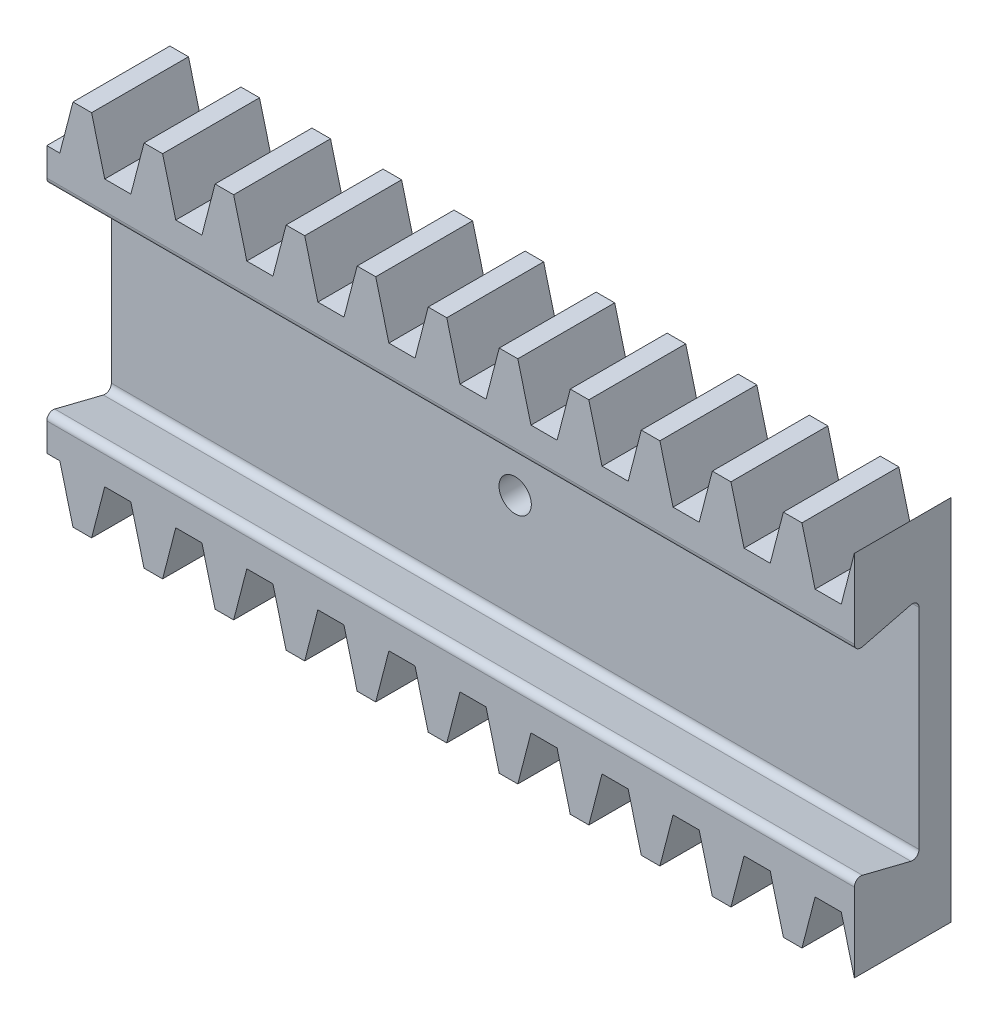
from build123d import *

# Parameters (mm, degrees)
BLANKSKE_W             = 25
BLANKSKE_H             = 5.7
BLANK_DEPTH            = 3
TOOTHCUTSIM_DEPTH      = 26.816467613
TEETHCUTS_COUNT        = 12
TEETHCUTS_PITCH        = 2.199114855
MIRROR_2_COPY_1_DEPTH  = 26.816467613
MIRROR_2_COPY_2_DEPTH  = 26.816467613
MIRROR_2_COPY_3_DEPTH  = 26.816467613
MIRROR_2_COPY_4_DEPTH  = 26.816467613
MIRROR_2_COPY_5_DEPTH  = 26.816467613
MIRROR_2_COPY_6_DEPTH  = 26.816467613
MIRROR_2_COPY_7_DEPTH  = 26.816467613
MIRROR_2_COPY_8_DEPTH  = 26.816467613
MIRROR_2_COPY_9_DEPTH  = 26.816467613
MIRROR_2_COPY_10_DEPTH = 26.816467613
MIRROR_2_COPY_11_DEPTH = 26.816467613
CUT_EXTRUDE_2_DEPTH    = 26.816467613
FILLET_1_R             = 0.2
FILLET_2_R             = 0.2
FILLET_3_R             = 0.2
SKETCH_2_R             = 1.5
EXTRUDE_1_DEPTH        = 1.5
SKETCH_3_R             = 0.5
CUT_EXTRUDE_3_DEPTH    = 27.033440034


with BuildPart() as part:
    # BlankSke → Blank (new body)
    with BuildSketch(Plane.XY):
        with Locations((12.5, 2.85)):
            Rectangle(BLANKSKE_W, BLANKSKE_H)
    blank = extrude(amount=-BLANK_DEPTH)

    # TooCutSkeSim → ToothCutSim (cut, through all)
    with BuildSketch(Plane.XY):
        Polygon((0.404488327, 4.125), (-0.404488327, 4.125), (-0.818379909, 5.7254), (0.818379909, 5.7254), align=None)
    toothcutsim = extrude(amount=-TOOTHCUTSIM_DEPTH, mode=Mode.SUBTRACT)

    # TeethCuts: ToothCutSim ×12
    with Locations(*[(i * TEETHCUTS_PITCH, 0, 0) for i in range(1, TEETHCUTS_COUNT)]):
        add(toothcutsim, mode=Mode.SUBTRACT)

    # 镜向2: Blank, ToothCutSim across plane
    add(blank.mirror(Plane(origin=(0, 0, -3), x_dir=(0, 0, 1), z_dir=(0, -1, 0))))
    add(toothcutsim.mirror(Plane(origin=(0, 0, -3), x_dir=(0, 0, 1), z_dir=(0, -1, 0))), mode=Mode.SUBTRACT)

    # 镜向2 copy 1 sketch → 镜向2 copy 1 (cut, through all)
    with BuildSketch(Plane(origin=(2.199114855, 0, 0), x_dir=(1, 0, 0), z_dir=(0, 0, 1))):
        Polygon((0.404488327, -4.125), (-0.404488327, -4.125), (-0.818379909, -5.7254), (0.818379909, -5.7254), align=None)
    extrude(amount=-MIRROR_2_COPY_1_DEPTH, mode=Mode.SUBTRACT)

    # 镜向2 copy 2 sketch → 镜向2 copy 2 (cut, through all)
    with BuildSketch(Plane(origin=(4.39822971, 0, 0), x_dir=(1, 0, 0), z_dir=(0, 0, 1))):
        Polygon((0.404488327, -4.125), (-0.404488327, -4.125), (-0.818379909, -5.7254), (0.818379909, -5.7254), align=None)
    extrude(amount=-MIRROR_2_COPY_2_DEPTH, mode=Mode.SUBTRACT)

    # 镜向2 copy 3 sketch → 镜向2 copy 3 (cut, through all)
    with BuildSketch(Plane(origin=(6.597344565, 0, 0), x_dir=(1, 0, 0), z_dir=(0, 0, 1))):
        Polygon((0.404488327, -4.125), (-0.404488327, -4.125), (-0.818379909, -5.7254), (0.818379909, -5.7254), align=None)
    extrude(amount=-MIRROR_2_COPY_3_DEPTH, mode=Mode.SUBTRACT)

    # 镜向2 copy 4 sketch → 镜向2 copy 4 (cut, through all)
    with BuildSketch(Plane(origin=(8.79645942, 0, 0), x_dir=(1, 0, 0), z_dir=(0, 0, 1))):
        Polygon((0.404488327, -4.125), (-0.404488327, -4.125), (-0.818379909, -5.7254), (0.818379909, -5.7254), align=None)
    extrude(amount=-MIRROR_2_COPY_4_DEPTH, mode=Mode.SUBTRACT)

    # 镜向2 copy 5 sketch → 镜向2 copy 5 (cut, through all)
    with BuildSketch(Plane(origin=(10.995574275, 0, 0), x_dir=(1, 0, 0), z_dir=(0, 0, 1))):
        Polygon((0.404488327, -4.125), (-0.404488327, -4.125), (-0.818379909, -5.7254), (0.818379909, -5.7254), align=None)
    extrude(amount=-MIRROR_2_COPY_5_DEPTH, mode=Mode.SUBTRACT)

    # 镜向2 copy 6 sketch → 镜向2 copy 6 (cut, through all)
    with BuildSketch(Plane(origin=(13.19468913, 0, 0), x_dir=(1, 0, 0), z_dir=(0, 0, 1))):
        Polygon((0.404488327, -4.125), (-0.404488327, -4.125), (-0.818379909, -5.7254), (0.818379909, -5.7254), align=None)
    extrude(amount=-MIRROR_2_COPY_6_DEPTH, mode=Mode.SUBTRACT)

    # 镜向2 copy 7 sketch → 镜向2 copy 7 (cut, through all)
    with BuildSketch(Plane(origin=(15.393803985, 0, 0), x_dir=(1, 0, 0), z_dir=(0, 0, 1))):
        Polygon((0.404488327, -4.125), (-0.404488327, -4.125), (-0.818379909, -5.7254), (0.818379909, -5.7254), align=None)
    extrude(amount=-MIRROR_2_COPY_7_DEPTH, mode=Mode.SUBTRACT)

    # 镜向2 copy 8 sketch → 镜向2 copy 8 (cut, through all)
    with BuildSketch(Plane(origin=(17.59291884, 0, 0), x_dir=(1, 0, 0), z_dir=(0, 0, 1))):
        Polygon((0.404488327, -4.125), (-0.404488327, -4.125), (-0.818379909, -5.7254), (0.818379909, -5.7254), align=None)
    extrude(amount=-MIRROR_2_COPY_8_DEPTH, mode=Mode.SUBTRACT)

    # 镜向2 copy 9 sketch → 镜向2 copy 9 (cut, through all)
    with BuildSketch(Plane(origin=(19.792033695, 0, 0), x_dir=(1, 0, 0), z_dir=(0, 0, 1))):
        Polygon((0.404488327, -4.125), (-0.404488327, -4.125), (-0.818379909, -5.7254), (0.818379909, -5.7254), align=None)
    extrude(amount=-MIRROR_2_COPY_9_DEPTH, mode=Mode.SUBTRACT)

    # 镜向2 copy 10 sketch → 镜向2 copy 10 (cut, through all)
    with BuildSketch(Plane(origin=(21.99114855, 0, 0), x_dir=(1, 0, 0), z_dir=(0, 0, 1))):
        Polygon((0.404488327, -4.125), (-0.404488327, -4.125), (-0.818379909, -5.7254), (0.818379909, -5.7254), align=None)
    extrude(amount=-MIRROR_2_COPY_10_DEPTH, mode=Mode.SUBTRACT)

    # 镜向2 copy 11 sketch → 镜向2 copy 11 (cut, through all)
    with BuildSketch(Plane(origin=(24.190263405, 0, 0), x_dir=(1, 0, 0), z_dir=(0, 0, 1))):
        Polygon((0.404488327, -4.125), (-0.404488327, -4.125), (-0.818379909, -5.7254), (0.818379909, -5.7254), align=None)
    extrude(amount=-MIRROR_2_COPY_11_DEPTH, mode=Mode.SUBTRACT)

    # 草图1 → 切除-拉伸2 (cut, through all)
    with BuildSketch(Plane.ZY):
        Polygon((0, -3), (0, 3), (-2, 3.5), (-2, -3.5), align=None)
    extrude(amount=-CUT_EXTRUDE_2_DEPTH, mode=Mode.SUBTRACT)

    # 圆角1
    fillet_1_edges = [part.edges().sort_by_distance(p)[0] for p in [
        (12.5, -3.5, -2),
    ]]
    fillet(fillet_1_edges, radius=FILLET_1_R)

    # 圆角2
    fillet_2_edges = [part.edges().sort_by_distance(p)[0] for p in [
        (12.5, 3.5, -2),
    ]]
    fillet(fillet_2_edges, radius=FILLET_2_R)

    # 圆角3
    fillet_3_edges = [part.edges().sort_by_distance(p)[0] for p in [
        (12.5, -3, 0),
        (12.5, 3, 0),
    ]]
    fillet(fillet_3_edges, radius=FILLET_3_R)

    # 草图2 → 凸台-拉伸1 (add)
    with BuildSketch(Plane(origin=(0, 0, -3), x_dir=(-1, 0, 0), z_dir=(0, 0, -1))):
        with Locations((-12.5, 0)):
            Circle(SKETCH_2_R)
    extrude(amount=EXTRUDE_1_DEPTH)

    # 草图3 → 切除-拉伸3 (cut, through all)
    with BuildSketch(Plane(origin=(0, 0, -4.5), x_dir=(-1, 0, 0), z_dir=(0, 0, -1))):
        with Locations((-12.5, 0)):
            Circle(SKETCH_3_R)
    extrude(amount=-CUT_EXTRUDE_3_DEPTH, mode=Mode.SUBTRACT)


solid = part.part
